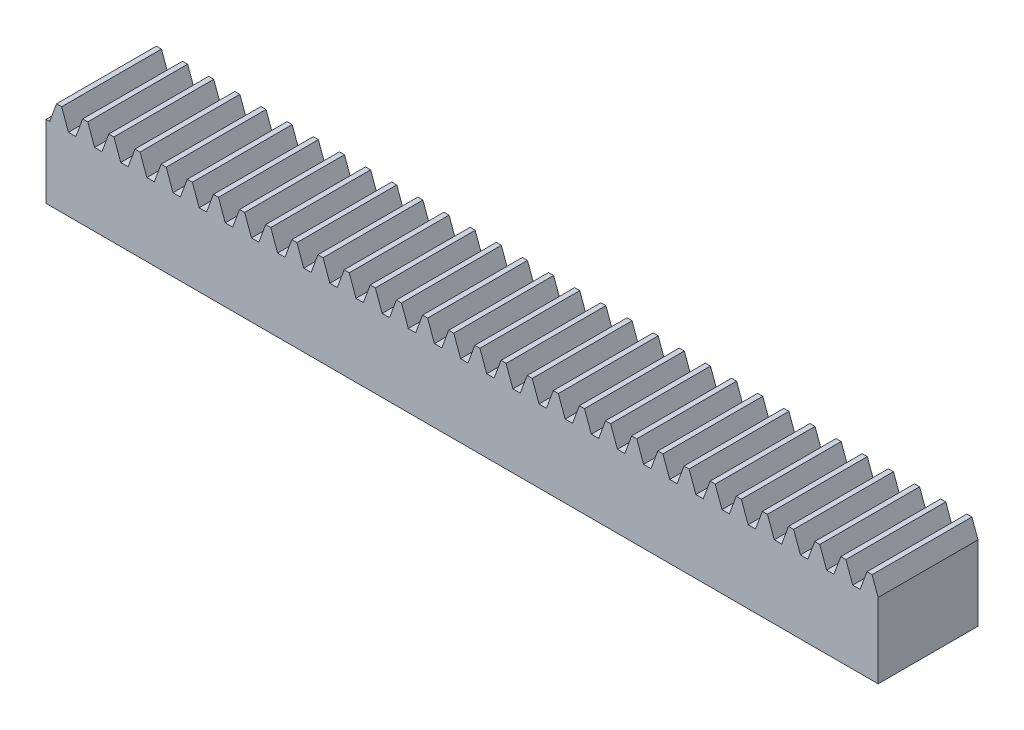
from build123d import *

# Parameters (mm, degrees)
BLANKSKE_W        = 100
BLANKSKE_H        = 11
BLANK_DEPTH       = 12
TOOTHCUTSIM_DEPTH = 102.316336294
TEETHCUTS_COUNT   = 33
TEETHCUTS_PITCH   = 3.14159265


with BuildPart() as part:
    # BlankSke → Blank (new body)
    with BuildSketch(Plane.XY):
        with Locations((50, 5.5)):
            Rectangle(BLANKSKE_W, BLANKSKE_H)
    extrude(amount=-BLANK_DEPTH)

    # TooCutSkeSim → ToothCutSim (cut, through all)
    with BuildSketch(Plane.XY):
        Polygon((0.44443537, 8.75), (-0.44443537, 8.75), (-1.272613241, 11.0254), (1.272613241, 11.0254), align=None)
    toothcutsim = extrude(amount=-TOOTHCUTSIM_DEPTH, mode=Mode.SUBTRACT)

    # TeethCuts: ToothCutSim ×33
    with Locations(*[(i * TEETHCUTS_PITCH, 0, 0) for i in range(1, TEETHCUTS_COUNT)]):
        add(toothcutsim, mode=Mode.SUBTRACT)


solid = part.part
